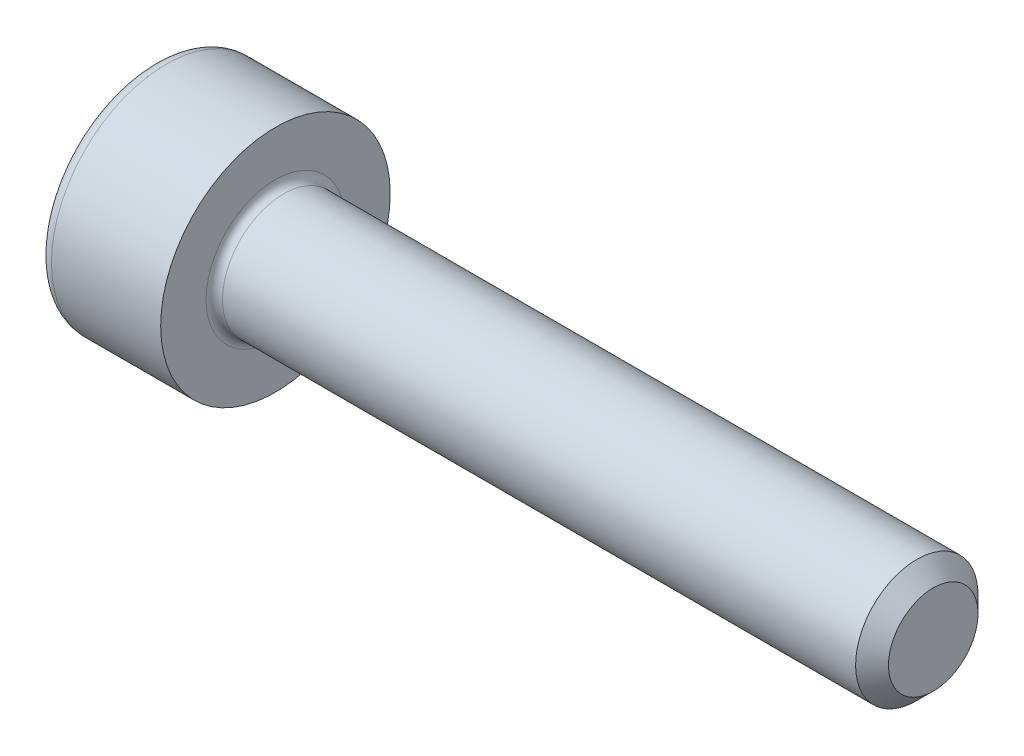
from build123d import *

# Parameters (mm, degrees)
FILLET1_R      = 0.1
FILLET2_R      = 0.16
CHAMFER1_SIZE  = 0.2
EXTRUDE1_DEPTH = 0.7


with BuildPart() as part:
    # Sketch1 → Revolve1 (revolve)
    with BuildSketch(Plane.XY, mode=Mode.PRIVATE) as revolve1_sk:
        Polygon((0, 1.395688245), (0, 0), (9.488734128, 0), (9.488734128, 0.744367064), (1.488734128, 0.744367064), (1.488734128, 1.395688245), align=None)
    revolve(revolve1_sk.sketch.rotate(Axis((0, 0, 0), (1, 0, 0)), 90), axis=Axis((0, 0, 0), (1, 0, 0)))

    # Fillet1
    fillet1_edges = [part.edges().sort_by_distance(p)[0] for p in [
        (1.488734128, 0, -0.744367064),
    ]]
    fillet(fillet1_edges, radius=FILLET1_R)

    # Fillet2
    fillet2_edges = [part.edges().sort_by_distance(p)[0] for p in [
        (0, 0, -1.395688245),
    ]]
    fillet(fillet2_edges, radius=FILLET2_R)

    # Chamfer1
    chamfer1_edges = [part.edges().sort_by_distance(p)[0] for p in [
        (9.488734128, 0, -0.744367064),
    ]]
    chamfer(chamfer1_edges, length=CHAMFER1_SIZE)

    # Sketch2 → Extrude1 (cut)
    with BuildSketch(Plane.ZY):
        Polygon((0, 0.877572409), (-0.76, 0.438786205), (-0.76, -0.438786205), (0, -0.877572409), (0.76, -0.438786205), (0.76, 0.438786205), align=None)
    extrude(amount=-EXTRUDE1_DEPTH, mode=Mode.SUBTRACT)


solid = part.part
